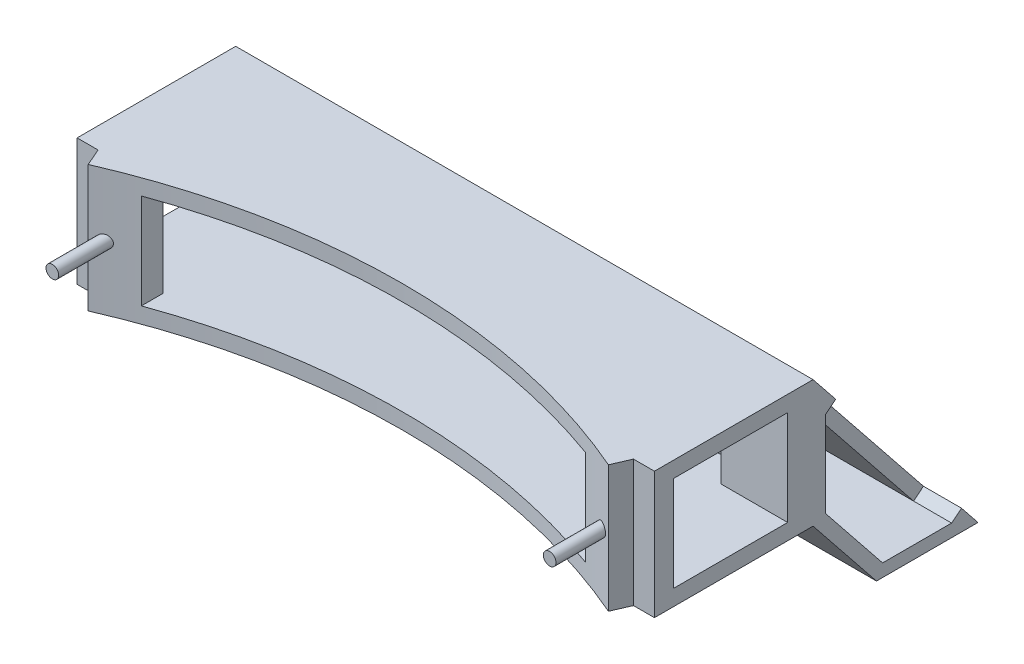
from build123d import *

# Parameters (mm, degrees)
EXTRUDE_1_DEPTH      = 20
SKETCH_2_W           = 200
SKETCH_2_H           = 1
EXTRUDE_2_DEPTH      = 20
SKETCH_3_R           = 1
EXTRUDE_3_DEPTH      = 100
SKETCH_4_W           = 70
SKETCH_4_H           = 15
CUT_EXTRUDE_1_DEPTH  = 150
CUT_EXTRUDE_START    = -150
CUT_EXTRUDE_2_DEPTH  = 150
EXTRUDE_4_DEPTH      = 20
SKETCH_7_W           = 70
SKETCH_7_H           = 15
CUT_EXTRUDE_3_DEPTH  = 50
SKETCH_8_W           = 18
SKETCH_8_H           = 15
CUT_EXTRUDE_4_DEPTH  = 50
SKETCH_9_W           = 18
SKETCH_9_H           = 15
CUT_EXTRUDE_5_DEPTH  = 50
SKETCH_10_W          = 241.24793126
SKETCH_10_H          = 101.321343747
CUT_EXTRUDE_6_DEPTH  = 50
SKETCH_11_W          = 124.388349514
SKETCH_11_H          = 45
EXTRUDE_5_DEPTH      = 10
CUT_EXTRUDE_7_DEPTH  = 200
EXTRUDE_6_DEPTH      = 124.5
CUT_EXTRUDE_8_DEPTH  = 134.5
SKETCH_15_W          = 13.694174757
SKETCH_15_H          = 51
SKETCH_15_W_2        = 13.805825243
CUT_EXTRUDE_9_DEPTH  = 40
CUT_EXTRUDE_10_DEPTH = 120
SKETCH_17_W          = 66
SKETCH_17_H          = 11
CUT_EXTRUDE_12_DEPTH = 120
SKETCH_18_W          = 3
SKETCH_18_H          = 51
CUT_EXTRUDE_13_DEPTH = 120
CUT_EXTRUDE_14_DEPTH = 6


with BuildPart() as part:
    # 草图1 → 凸台-拉伸1 (new body)
    with BuildSketch(Plane(origin=(0, 0, 0), x_dir=(1, 0, 0), z_dir=(0, 1, 0))):
        with BuildLine():
            Line((-42.194174757, 97.24017491), (-41, 94.488094488))
            ThreePointArc((-41, 94.488094488), (0, 103), (41, 94.488094488))
            Line((41, 94.488094488), (42.194174757, 97.24017491))
            ThreePointArc((42.194174757, 97.24017491), (0, 106), (-42.194174757, 97.24017491))
        make_face()
    extrude(amount=EXTRUDE_1_DEPTH)



with BuildPart() as body_2:
    # 草图2 → 凸台-拉伸2 (new body)
    with BuildSketch(Plane.XZ):
        with Locations((0, -0.5)):
            Rectangle(SKETCH_2_W, SKETCH_2_H)
    extrude(amount=-EXTRUDE_2_DEPTH)


with BuildPart() as part_1:
    add(part.part)

    add(body_2.part)  # 凸台-拉伸3 merges body 2
    # 草图3 → 凸台-拉伸3 (add)
    with BuildSketch(Plane(origin=(0, 0, -1), x_dir=(-1, 0, 0), z_dir=(0, 0, -1))):
        with Locations(Location((-39.194174757, 10, 0), (0, 0, 180))):
            Circle(SKETCH_3_R)
        with Locations(Location((39.194174757, 10, 0), (0, 0, 180))):
            Circle(SKETCH_3_R)
    extrude(amount=EXTRUDE_3_DEPTH)

    # 草图4 → 切除-拉伸1 (cut)
    with BuildSketch(Plane(origin=(0, 0, -1), x_dir=(-1, 0, 0), z_dir=(0, 0, -1))):
        with Locations((0, 10)):
            Rectangle(SKETCH_4_W, SKETCH_4_H)
    extrude(amount=CUT_EXTRUDE_1_DEPTH, mode=Mode.SUBTRACT)

    # 草图5 → 切除-拉伸2 (cut)
    with BuildSketch(Plane(origin=(0, 20, 0), x_dir=(1, 0, 0), z_dir=(0, 1, 0)).offset(CUT_EXTRUDE_START)):
        with BuildLine():
            Line((-49.057927096, 113.337024581), (-42.194174757, 97.24017491))
            ThreePointArc((-42.194174757, 97.24017491), (0, 106), (42.194174757, 97.24017491))
            Line((42.194174757, 97.24017491), (51.628141839, 112.189555316))
            ThreePointArc((51.628141839, 112.189555316), (1.407363629, 123.490812126), (-49.057927096, 113.337024581))
        make_face()
    extrude(amount=CUT_EXTRUDE_2_DEPTH, mode=Mode.SUBTRACT)

    # 草图6 → 凸台-拉伸4 (add)
    with BuildSketch(Plane.XZ):
        with BuildLine():
            Line((-42.194174757, -97.24017491), (-62.194174757, -97.24017491))
            Line((-62.194174757, -97.24017491), (-62.194174757, -122.24017491))
            Line((-62.194174757, -122.24017491), (62.194174757, -122.24017491))
            Line((62.194174757, -122.24017491), (62.194174757, -97.24017491))
            Line((62.194174757, -97.24017491), (42.194174757, -97.24017491))
            ThreePointArc((42.194174757, -97.24017491), (0, -106), (-42.194174757, -97.24017491))
        make_face()
    extrude(amount=-EXTRUDE_4_DEPTH)

    # 草图7 → 切除-拉伸3 (cut)
    with BuildSketch(Plane(origin=(0, 0, -122.24017491), x_dir=(-1, 0, 0), z_dir=(0, 0, -1))):
        with Locations((0, 10)):
            Rectangle(SKETCH_7_W, SKETCH_7_H)
    extrude(amount=-CUT_EXTRUDE_3_DEPTH, mode=Mode.SUBTRACT)

    # 草图8 → 切除-拉伸4 (cut)
    with BuildSketch(Plane.ZY.offset(62.194174757)):
        with Locations((-109.24017491, 10)):
            Rectangle(SKETCH_8_W, SKETCH_8_H)
    extrude(amount=-CUT_EXTRUDE_4_DEPTH, mode=Mode.SUBTRACT)

    # 草图9 → 切除-拉伸5 (cut)
    with BuildSketch(Plane(origin=(62.194174757, 0, 0), x_dir=(0, 0, -1), z_dir=(1, 0, 0))):
        with Locations((109.24017491, 10)):
            Rectangle(SKETCH_9_W, SKETCH_9_H)
    extrude(amount=-CUT_EXTRUDE_5_DEPTH, mode=Mode.SUBTRACT)

    # 草图10 → 切除-拉伸6 (cut)
    with BuildSketch(Plane(origin=(0, 20, 0), x_dir=(1, 0, 0), z_dir=(0, 1, 0))):
        with Locations((-3.693281443, 36.368377787)):
            Rectangle(SKETCH_10_W, SKETCH_10_H)
    extrude(amount=-CUT_EXTRUDE_6_DEPTH, mode=Mode.SUBTRACT)

    # 草图11 → 凸台-拉伸5 (add)
    with BuildSketch(Plane(origin=(0, 0, -122.24017491), x_dir=(-1, 0, 0), z_dir=(0, 0, -1))):
        with Locations((0, 10)):
            Rectangle(SKETCH_11_W, SKETCH_11_H)
    extrude(amount=EXTRUDE_5_DEPTH)

    # 草图12 → 切除-拉伸7 (cut)
    with BuildSketch(Plane(origin=(62.194174757, 0, 0), x_dir=(0, 0, -1), z_dir=(1, 0, 0))):
        Polygon((122.24017491, 20), (132.24017491, 32.5), (122.24017491, 32.5), align=None)
        Polygon((122.24017491, 0), (132.24017491, -12.5), (122.24017491, -12.5), align=None)
    extrude(amount=-CUT_EXTRUDE_7_DEPTH, mode=Mode.SUBTRACT)

    # 草图13 → 凸台-拉伸6 (add)
    with BuildSketch(Plane(origin=(62.194174757, 0, 0), x_dir=(0, 0, -1), z_dir=(1, 0, 0))):
        Polygon((122.24017491, 0), (132.24017491, -12.5), (148.24017491, -12.5), (122.24017491, 20), align=None)
    extrude(amount=-EXTRUDE_6_DEPTH)

    # 草图14 → 切除-拉伸8 (cut)
    with BuildSketch(Plane(origin=(62.194174757, 0, 0), x_dir=(0, 0, -1), z_dir=(1, 0, 0))):
        Polygon((122.24017491, 20), (132.24017491, 7.5), (132.24017491, 32.5), align=None)
    extrude(amount=-CUT_EXTRUDE_8_DEPTH, mode=Mode.SUBTRACT)

    # 草图15 → 切除-拉伸9 (cut)
    with BuildSketch(Plane(origin=(0, 20, 0), x_dir=(1, 0, 0), z_dir=(0, 1, 0))):
        with Locations((55.347087379, 122.74017491)):
            Rectangle(SKETCH_15_W, SKETCH_15_H)
        with Locations((-55.402912622, 122.74017491)):
            Rectangle(SKETCH_15_W_2, SKETCH_15_H)
    extrude(amount=-CUT_EXTRUDE_9_DEPTH, mode=Mode.SUBTRACT)

    # 草图16 → 切除-拉伸10 (cut)
    with BuildSketch(Plane.ZY.offset(48.5)):
        Polygon((-124.24017491, 14.298437881), (-144.078925215, -10.5), (-133.201424605, -10.5), (-124.24017491, 0.701562119), align=None)
    extrude(amount=-CUT_EXTRUDE_10_DEPTH, mode=Mode.SUBTRACT)

    # 草图17 → 切除-拉伸12 (cut)
    with BuildSketch(Plane(origin=(0, 0, -124.24017491), x_dir=(-1, 0, 0), z_dir=(0, 0, -1))):
        with Locations((0, 10)):
            Rectangle(SKETCH_17_W, SKETCH_17_H)
    extrude(amount=-CUT_EXTRUDE_12_DEPTH, mode=Mode.SUBTRACT)

    # 草图18 → 切除-拉伸13 (cut)
    with BuildSketch(Plane(origin=(0, 20, 0), x_dir=(1, 0, 0), z_dir=(0, 1, 0))):
        with Locations((-47, 122.74017491)):
            Rectangle(SKETCH_18_W, SKETCH_18_H)
        with Locations((47, 122.74017491)):
            Rectangle(SKETCH_18_W, SKETCH_18_H)
    extrude(amount=-CUT_EXTRUDE_13_DEPTH, mode=Mode.SUBTRACT)

    # 草图22 → 切除-拉伸14 (cut)
    with BuildSketch(Plane(origin=(45.5, 0, 0), x_dir=(0, 0, -1), z_dir=(1, 0, 0))):
        Polygon((124.24017491, 14.298437881), (144.078925215, -10.5), (147.983269262, -7.376524762), (128.144518957, 17.421913119), align=None)
    extrude(amount=-CUT_EXTRUDE_14_DEPTH, mode=Mode.SUBTRACT)


solid = part_1.part
